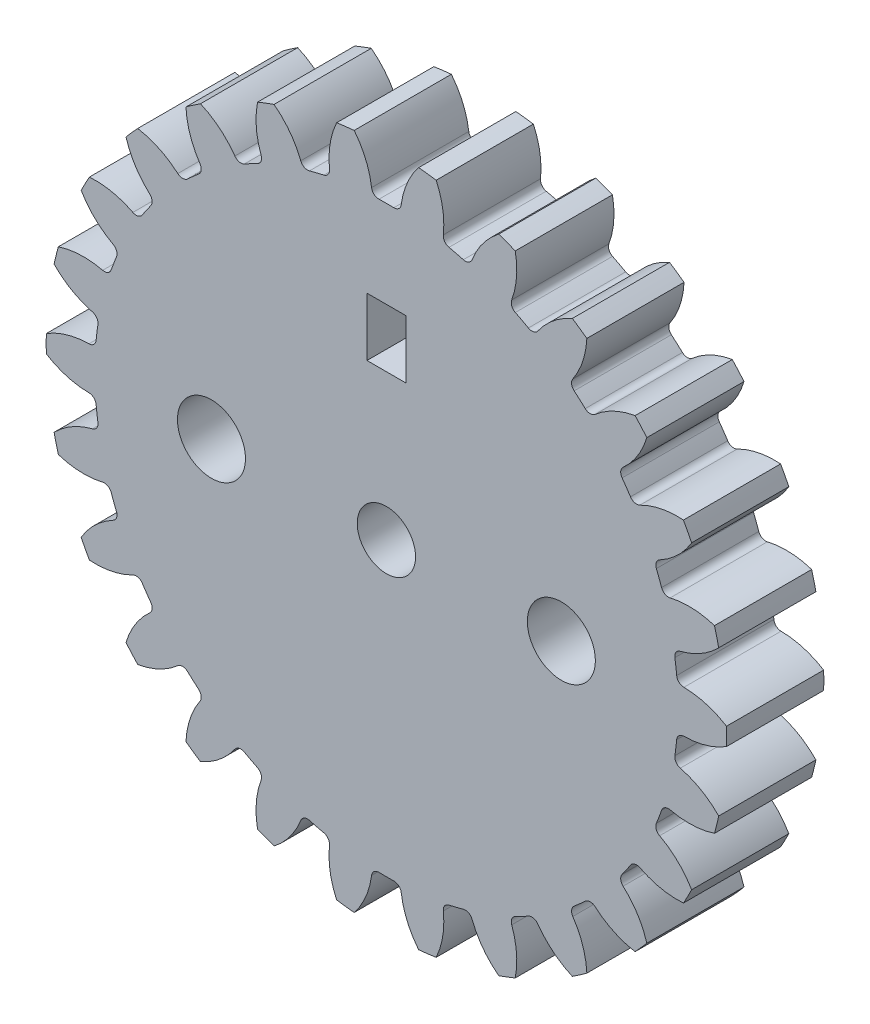
from build123d import *

# Parameters (mm, degrees)
SKETCH1_R                   = 17.5
BOSS_EXTRUDE1_DEPTH         = 2.5
CUT_EXTRUDE1_DEPTH          = 25.874685928
FILLET2_R                   = 0.375
CIRPATTERN1_COUNT           = 26
FILLET2_OF_CIRPATTERN1_R    = 0.375
STRING_HOLE_DEPTH           = 25.819388405
STRING_HOLE_DEPTH_BACK      = 25.819388405
SKETCH4_R                   = 1.5
TO_KNUCKLE_MOUNT_DEPTH      = 25.819388405
TO_KNUCKLE_MOUNT_DEPTH_BACK = 25.819388405
SKETCH5_R                   = 1.75
SKETCH6_W                   = 2
SKETCH6_H                   = 3
FOR_ALIGNMENT_DEPTH         = 2


with BuildPart() as part:
    # Sketch1 → Boss-Extrude1 (new, symmetric)
    with BuildSketch(Plane.XY):
        Circle(SKETCH1_R)
    extrude(amount=BOSS_EXTRUDE1_DEPTH, both=True)

    # Sketch3 → Cut-Extrude1 (cut, symmetric)
    with BuildSketch(Plane.XY):
        with BuildLine():
            ThreePointArc((-0.731537344, 14.982151151), (0, 15), (0.731537344, 14.982151151))
            ThreePointArc((0.731537344, 14.982151151), (1.001492244, 16.275061461), (1.657699213, 17.421309748))
            ThreePointArc((1.657699213, 17.421309748), (0, 17.5), (-1.657699213, 17.421309748))
            ThreePointArc((-1.657699213, 17.421309748), (-1.001492244, 16.275061461), (-0.731537344, 14.982151151))
        make_face()
    cut_extrude1 = extrude(amount=CUT_EXTRUDE1_DEPTH, both=True, mode=Mode.SUBTRACT)

    # Fillet2
    fillet2_edges = [part.edges().sort_by_distance(p)[0] for p in [
        (0.731537344, 14.982151151, 0),
        (-0.731537344, 14.982151151, 0),
    ]]
    fillet(fillet2_edges, radius=FILLET2_R)

    # CirPattern1: Cut-Extrude1 ×26 about axis
    cirpattern1_axis = Axis((0, 0, 0), (0, 0, 1))
    for i in range(1, CIRPATTERN1_COUNT):
        add(cut_extrude1.rotate(cirpattern1_axis, i * 360 / CIRPATTERN1_COUNT), mode=Mode.SUBTRACT)

    # Fillet2 of CirPattern1
    fillet2_of_cirpattern1_edges = [part.edges().sort_by_distance(p)[0] for p in [
        (-2.875183257, 14.721865413, 0),
        (-4.295743653, 14.371728722, 0),
        (-6.314808658, 13.605998369, 0),
        (-7.610296956, 12.926073659, 0),
        (-9.387440333, 11.699400155, 0),
        (-10.482567462, 10.729202179, 0),
        (-11.914508098, 9.11287533, 0),
        (-12.74562925, 7.908788468, 0),
        (-13.74914796, 5.996743315, 0),
        (-14.267961394, 4.628744718, 0),
        (-14.784737318, 2.532102376, 0),
        (-14.961091484, 1.07969515, 0),
        (-14.961091484, -1.07969515, 0),
        (-14.784737318, -2.532102376, 0),
        (-14.267961394, -4.628744718, 0),
        (-13.74914796, -5.996743315, 0),
        (-12.74562925, -7.908788468, 0),
        (-11.914508098, -9.11287533, 0),
        (-10.482567462, -10.729202179, 0),
        (-9.387440333, -11.699400155, 0),
        (-7.610296956, -12.926073659, 0),
        (-6.314808658, -13.605998369, 0),
        (-4.295743653, -14.371728722, 0),
        (-2.875183257, -14.721865413, 0),
        (-0.731537344, -14.982151151, 0),
        (0.731537344, -14.982151151, 0),
        (2.875183257, -14.721865413, 0),
        (4.295743653, -14.371728722, 0),
        (6.314808658, -13.605998369, 0),
        (7.610296956, -12.926073659, 0),
        (9.387440333, -11.699400155, 0),
        (10.482567462, -10.729202179, 0),
        (11.914508098, -9.11287533, 0),
        (12.74562925, -7.908788468, 0),
        (13.74914796, -5.996743315, 0),
        (14.267961394, -4.628744718, 0),
        (14.784737318, -2.532102376, 0),
        (14.961091484, -1.07969515, 0),
        (14.961091484, 1.07969515, 0),
        (14.784737318, 2.532102376, 0),
        (14.267961394, 4.628744718, 0),
        (13.74914796, 5.996743315, 0),
        (12.74562925, 7.908788468, 0),
        (11.914508098, 9.11287533, 0),
        (10.482567462, 10.729202179, 0),
        (9.387440333, 11.699400155, 0),
        (7.610296956, 12.926073659, 0),
        (6.314808658, 13.605998369, 0),
        (4.295743653, 14.371728722, 0),
        (2.875183257, 14.721865413, 0),
    ]]
    fillet(fillet2_of_cirpattern1_edges, radius=FILLET2_OF_CIRPATTERN1_R)

    # Sketch4 → String_Hole (cut, two sides: drawn at the far end of the back side and taken through both)
    with BuildSketch(Plane.XY.offset(-STRING_HOLE_DEPTH_BACK)):
        Circle(SKETCH4_R)
    extrude(amount=STRING_HOLE_DEPTH + STRING_HOLE_DEPTH_BACK, mode=Mode.SUBTRACT)

    # Sketch5 → To_Knuckle_Mount (cut, two sides: drawn at the far end of the back side and taken through both)
    with BuildSketch(Plane.XY.offset(-TO_KNUCKLE_MOUNT_DEPTH_BACK)):
        with Locations((9, 0)):
            Circle(SKETCH5_R)
        with Locations((-9, 0)):
            Circle(SKETCH5_R)
    extrude(amount=TO_KNUCKLE_MOUNT_DEPTH + TO_KNUCKLE_MOUNT_DEPTH_BACK, mode=Mode.SUBTRACT)

    # Sketch6 → For_Alignment (cut)
    with BuildSketch(Plane.XY.offset(2.5)):
        with Locations((0, 9)):
            Rectangle(SKETCH6_W, SKETCH6_H)
    extrude(amount=-FOR_ALIGNMENT_DEPTH, mode=Mode.SUBTRACT)


solid = part.part
